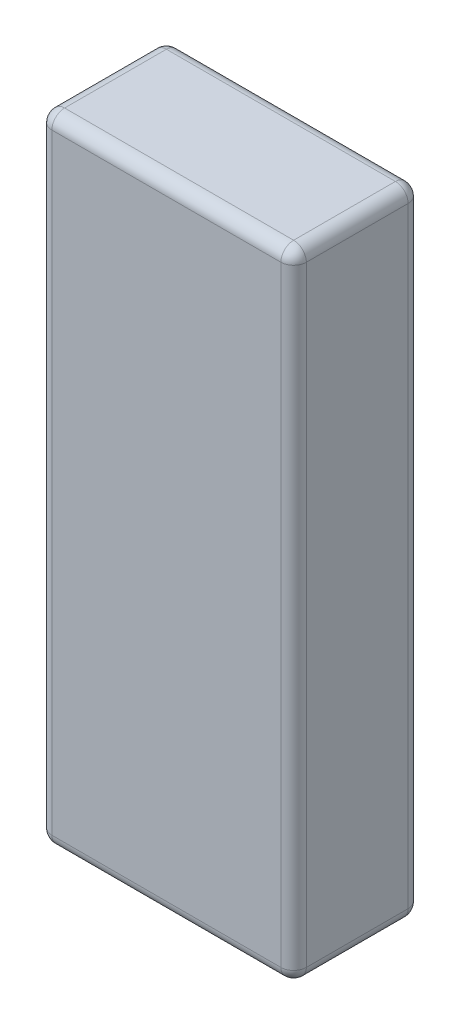
from build123d import *

# Parameters (mm, degrees)
SKETCH_1_W      = 20
SKETCH_1_H      = 50
EXTRUDE_1_DEPTH = 10
FILLET_1_R      = 1


with BuildPart() as part:
    # 草图1 → 凸台-拉伸1 (new body)
    with BuildSketch(Plane.XY):
        Rectangle(SKETCH_1_W, SKETCH_1_H)
    extrude(amount=EXTRUDE_1_DEPTH)

    # 圆角1
    fillet_1_edges = [part.edges().sort_by_distance(p)[0] for p in [
        (-10, 0, 10),
        (0, -25, 10),
        (10, 0, 10),
        (0, -25, 0),
        (-10, 0, 0),
        (0, 25, 0),
        (10, 0, 0),
        (10, -25, 5),
        (-10, -25, 5),
        (-10, 25, 5),
        (10, 25, 5),
        (0, 25, 10),
    ]]
    fillet(fillet_1_edges, radius=FILLET_1_R)


solid = part.part
